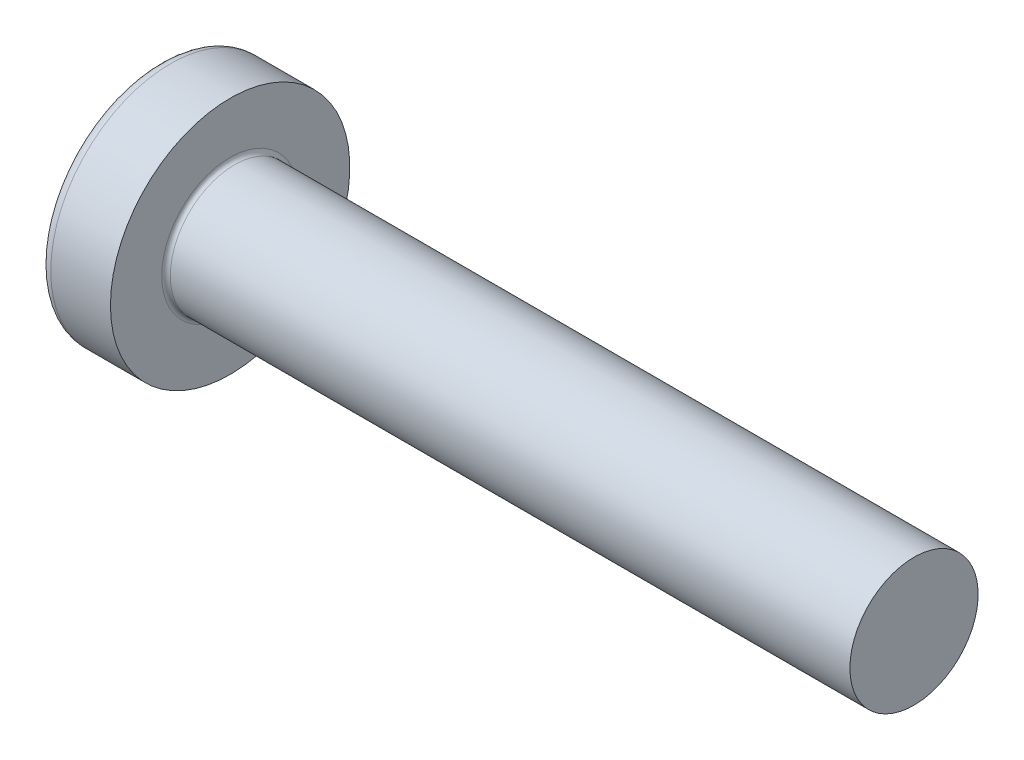
from build123d import *

# Parameters (mm, degrees)
FILLET1_R    = 0.1
RECPAT_COUNT = 2
RECPAT_ANGLE = 90


with BuildPart() as part:
    # BodySke → Base-Revolve (revolve)
    with BuildSketch(Plane.XY, mode=Mode.PRIVATE) as base_revolve_sk:
        with BuildLine():
            Line((2.4, 1.5), (2.4, 2.8))
            Line((2.4, 2.8), (1.003501533, 2.8))
            ThreePointArc((1.003501533, 2.8), (0.873295971, 2.76653015), (0.775371599, 2.674418605))
            ThreePointArc((0.775371599, 2.674418605), (0.197753546, 1.392274756), (0, 0))
            Line((0, 0), (18.4, 0))
            Line((18.4, 0), (18.4, 1.5))
            Line((18.4, 1.5), (2.4, 1.5))
        make_face()
    revolve(base_revolve_sk.sketch.rotate(Axis((1.003501533, 0, 0), (1, 0, 0)), 90), axis=Axis((1.003501533, 0, 0), (1, 0, 0)))

    # Fillet1
    fillet1_edges = [part.edges().sort_by_distance(p)[0] for p in [
        (2.4, 0, -1.5),
    ]]
    fillet(fillet1_edges, radius=FILLET1_R)

    # Sketch3 → Recess section 0
    with BuildSketch(Plane(origin=(0, 0, 0), x_dir=(0, 0, -1), z_dir=(1, 0, 0))):
        with BuildLine():
            Line((0.37, -1.4), (-0.37, -1.4))
            Line((-0.37, -1.4), (-0.37, 1.4))
            Line((-0.37, 1.4), (0.37, 1.4))
            Line((0.37, 1.4), (0.37, -1.4))
        make_face()
    # Sketch4 → Recess section 1
    with BuildSketch(Plane(origin=(1.75, 0, 0), x_dir=(0, 0, -1), z_dir=(1, 0, 0))):
        with BuildLine():
            Line((0.37, -0.527482216), (-0.37, -0.527482216))
            Line((-0.37, -0.527482216), (-0.37, 0.527482216))
            Line((-0.37, 0.527482216), (0.37, 0.527482216))
            Line((0.37, 0.527482216), (0.37, -0.527482216))
        make_face()
    recess = loft(mode=Mode.SUBTRACT)

    # RecPat: Recess ×2 about axis
    recpat_axis = Axis((0, 0, 0), (1, 0, 0))
    for i in range(1, RECPAT_COUNT):
        add(recess.rotate(recpat_axis, i * RECPAT_ANGLE / (RECPAT_COUNT - 1)), mode=Mode.SUBTRACT)

    # RecCorSke → RecessCore (revolve, cut)
    with BuildSketch(Plane.XY, mode=Mode.PRIVATE) as recesscore_sk:
        Polygon((0, 0), (0, 0.678371921), (1.75, 0.556), (1.930655351, 0), align=None)
    revolve(recesscore_sk.sketch.rotate(Axis((-3.175, 0, 0), (1, 0, 0)), 15.814025764), axis=Axis((-3.175, 0, 0), (1, 0, 0)), mode=Mode.SUBTRACT)


solid = part.part
